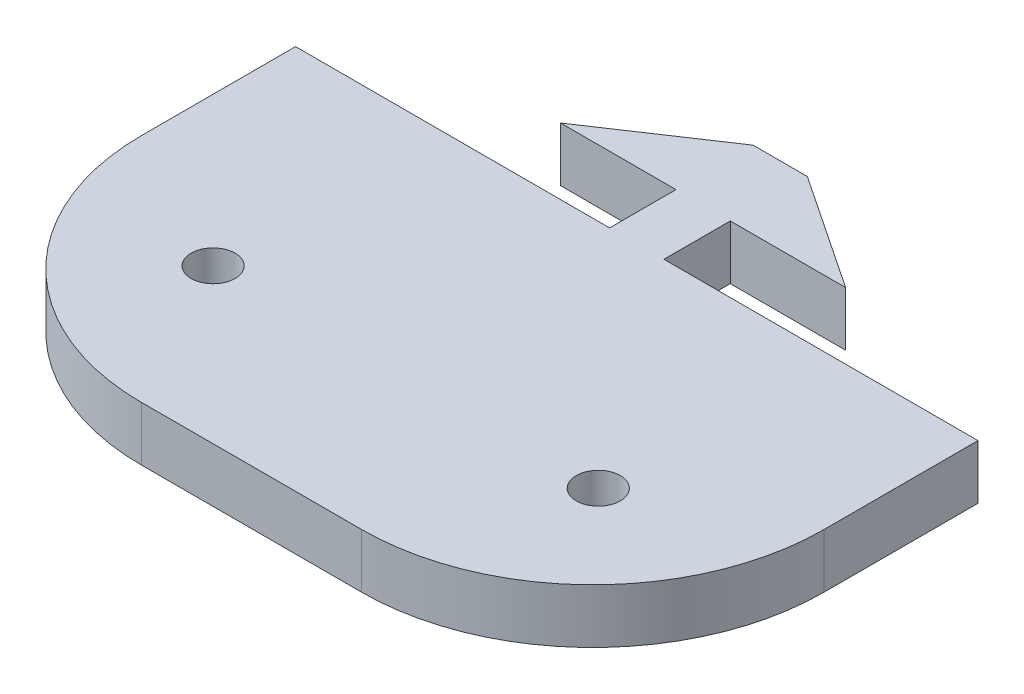
from build123d import *

# Parameters (mm, degrees)
BOSS_EXTRUDE1_DEPTH = 3.5814
SKETCH2_R           = 1.45
CUT_EXTRUDE1_DEPTH  = 36.779135205
FILLET1_R           = 15.24


with BuildPart() as part:
    # Sketch1 → Boss-Extrude1 (new body)
    with BuildSketch(Plane(origin=(0, 0, 0), x_dir=(1, 0, 0), z_dir=(0, 1, 0))):
        Polygon((-22.5, -27.5874988), (22.5, -27.5874988), (22.5, -2.1874988), (1.7907, -2.1874988), (1.7907, 2.1874988), (9.398, 2.1874988), (1.7907, 7.2674988), (-1.7907, 7.2674988), (-9.398, 2.1874988), (-1.7907, 2.1874988), (-1.7907, -2.1874988), (-22.5, -2.1874988), align=None)
    extrude(amount=BOSS_EXTRUDE1_DEPTH)

    # Sketch2 → Cut-Extrude1 (cut, through all)
    with BuildSketch(Plane(origin=(0, 3.5814, 0), x_dir=(1, 0, 0), z_dir=(0, 1, 0))):
        with Locations(Location((-12.7, -17.4274988, 0), (0, 0, 270))):
            Circle(SKETCH2_R)
        with Locations(Location((12.7, -17.4274988, 0), (0, 0, 270))):
            Circle(SKETCH2_R)
    extrude(amount=-CUT_EXTRUDE1_DEPTH, mode=Mode.SUBTRACT)

    # Fillet1
    fillet1_edges = [part.edges().sort_by_distance(p)[0] for p in [
        (-22.5, 1.7907, 27.5874988),
        (22.5, 1.7907, 27.5874988),
    ]]
    fillet(fillet1_edges, radius=FILLET1_R)


solid = part.part
